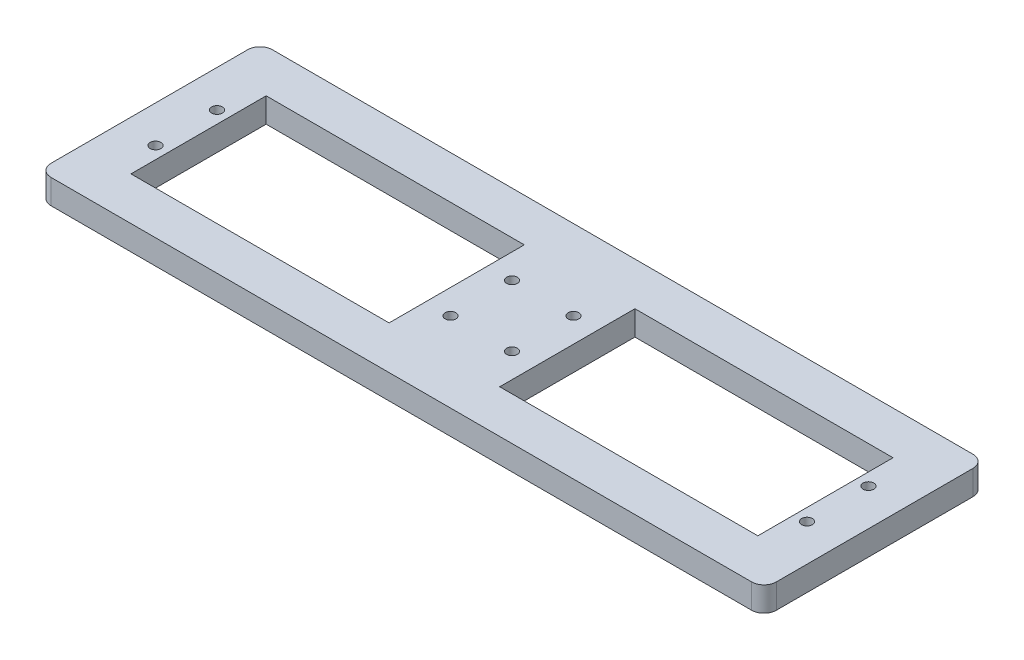
from build123d import *

# Parameters (mm, degrees)
SKETCH2_W           = 42
SKETCH2_H           = 22
BOSS_EXTRUDE1_DEPTH = 4
SKETCH3_R           = 0.875
CUT_EXTRUDE1_DEPTH  = 10
SKETCH4_R           = 0.875
CUT_EXTRUDE2_DEPTH  = 10


with BuildPart() as part:
    # Sketch2 → Boss-Extrude1 (new body)
    with BuildSketch(Plane(origin=(0, 0, 0), x_dir=(1, 0, 0), z_dir=(0, 1, 0))):
        with BuildLine():
            Line((-57, 18), (57, 18))
            ThreePointArc((57, 18), (58.414213562, 17.414213562), (59, 16))
            Line((59, 16), (59, -16))
            ThreePointArc((59, -16), (58.414213562, -17.414213562), (57, -18))
            Line((57, -18), (-57, -18))
            ThreePointArc((-57, -18), (-58.414213562, -17.414213562), (-59, -16))
            Line((-59, -16), (-59, 16))
            ThreePointArc((-59, 16), (-58.414213562, 17.414213562), (-57, 18))
        make_face()
        with Locations((-30, 0)):
            Rectangle(SKETCH2_W, SKETCH2_H, mode=Mode.SUBTRACT)
        with Locations((30, 0)):
            Rectangle(SKETCH2_W, SKETCH2_H, mode=Mode.SUBTRACT)
    extrude(amount=BOSS_EXTRUDE1_DEPTH)

    # Sketch3 → Cut-Extrude1 (cut)
    with BuildSketch(Plane.XZ):
        with Locations(Location((-53, 5, 0), (0, 0, 270))):
            Circle(SKETCH3_R)
        with Locations(Location((-53, -5, 0), (0, 0, 270))):
            Circle(SKETCH3_R)
    cut_extrude1 = extrude(amount=-CUT_EXTRUDE1_DEPTH, mode=Mode.SUBTRACT)

    # Sketch4 → Cut-Extrude2 (cut)
    with BuildSketch(Plane.XZ):
        with Locations(Location((-5, 5, 0), (0, 0, 270))):
            Circle(SKETCH4_R)
        with Locations(Location((-5, -5, 0), (0, 0, 270))):
            Circle(SKETCH4_R)
    cut_extrude2 = extrude(amount=-CUT_EXTRUDE2_DEPTH, mode=Mode.SUBTRACT)

    # Mirror1: Cut-Extrude1, Cut-Extrude2 across plane
    add(cut_extrude1.mirror(Plane(origin=(0, 0, 0), x_dir=(0, 0, 1), z_dir=(1, 0, 0))), mode=Mode.SUBTRACT)
    add(cut_extrude2.mirror(Plane(origin=(0, 0, 0), x_dir=(0, 0, 1), z_dir=(1, 0, 0))), mode=Mode.SUBTRACT)


solid = part.part
